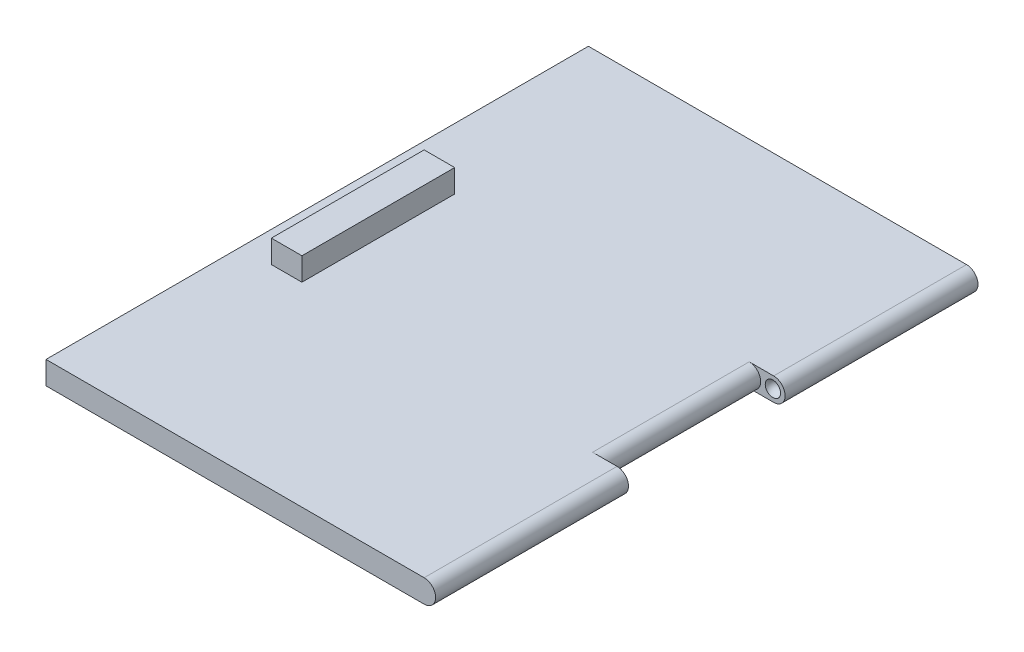
from build123d import *

# Parameters (mm, degrees)
SKETCH1_W           = 51
SKETCH1_H           = 71
BOSS_EXTRUDE1_DEPTH = 3
SKETCH2_W           = 4
SKETCH2_H           = 20
BOSS_EXTRUDE3_DEPTH = 3
SKETCH4_W           = 3.2
SKETCH4_H           = 20.5
CUT_EXTRUDE1_DEPTH  = 5
FILLET1_RADIUS      = 1.5
FILLET1_LENGTH      = 25.25
FILLET2_RADIUS      = 1.5
FILLET2_LENGTH      = 20.5
FILLET3_RADIUS      = 1.5
FILLET3_LENGTH      = 25.25


with BuildPart() as part:
    # Sketch1 → Boss-Extrude1 (new body)
    with BuildSketch(Plane(origin=(0, 0, 0), x_dir=(1, 0, 0), z_dir=(0, 1, 0))):
        Rectangle(SKETCH1_W, SKETCH1_H)
    extrude(amount=BOSS_EXTRUDE1_DEPTH)

    # Sketch2 → Boss-Extrude3 (add)
    with BuildSketch(Plane(origin=(0, 3, 0), x_dir=(1, 0, 0), z_dir=(0, 1, 0))):
        with Locations((-19.5, 0)):
            Rectangle(SKETCH2_W, SKETCH2_H)
    extrude(amount=BOSS_EXTRUDE3_DEPTH)

    # Sketch4 → Cut-Extrude1 (cut)
    with BuildSketch(Plane(origin=(0, 3, 0), x_dir=(1, 0, 0), z_dir=(0, 1, 0))):
        with Locations((23.9, 0)):
            Rectangle(SKETCH4_W, SKETCH4_H)
    extrude(amount=-CUT_EXTRUDE1_DEPTH, mode=Mode.SUBTRACT)

    # Sketch6 → Cut-Revolve1 (revolve, cut)
    with BuildSketch(Plane.XY.offset(-10.25)):
        with BuildLine():
            Line((22.90000003, 1.5), (24.89999997, 1.5))
            ThreePointArc((24.89999997, 1.5), (23.9, 0.50000003), (22.90000003, 1.5))
        make_face()
    cut_revolve1 = revolve(axis=Axis((22.90000003, 1.5, -10.25), (1, 0, 0)), mode=Mode.SUBTRACT)

    # Mirror1: Cut-Revolve1 across plane
    add(cut_revolve1.mirror(Plane.XY), mode=Mode.SUBTRACT)

    # Fillet1: full round fillet: the end face becomes a half cylinder, R = half its width
    fillet1_face = Plane((25.5, 1.5, 22.875), x_dir=(0, 0, 1), z_dir=(1, 0, 0))  # on the end face: x along it, z out of the body
    fillet1_slab = fillet1_face.offset(-FILLET1_RADIUS / 2) * Box(FILLET1_LENGTH, 2 * FILLET1_RADIUS, FILLET1_RADIUS, mode=Mode.PRIVATE)  # the body's end, R deep
    fillet1_round = Plane((24, 1.5, 22.875), x_dir=(1, 0, 0), z_dir=(0, 0, 1)) * Cylinder(FILLET1_RADIUS, FILLET1_LENGTH, mode=Mode.PRIVATE)  # its axis R under the face
    add(fillet1_slab - fillet1_round, mode=Mode.SUBTRACT)

    # Fillet2: full round fillet: the end face becomes a half cylinder, R = half its width
    fillet2_face = Plane((22.3, 1.5, 0), x_dir=(0, 0, -1), z_dir=(1, 0, 0))  # on the end face: x along it, z out of the body
    fillet2_slab = fillet2_face.offset(-FILLET2_RADIUS / 2) * Box(FILLET2_LENGTH, 2 * FILLET2_RADIUS, FILLET2_RADIUS, mode=Mode.PRIVATE)  # the body's end, R deep
    fillet2_round = Plane((20.8, 1.5, 0), x_dir=(1, 0, 0), z_dir=(0, 0, -1)) * Cylinder(FILLET2_RADIUS, FILLET2_LENGTH, mode=Mode.PRIVATE)  # its axis R under the face
    add(fillet2_slab - fillet2_round, mode=Mode.SUBTRACT)

    # Fillet3: full round fillet: the end face becomes a half cylinder, R = half its width
    fillet3_face = Plane((25.5, 1.5, -22.875), x_dir=(0, 0, -1), z_dir=(1, 0, 0))  # on the end face: x along it, z out of the body
    fillet3_slab = fillet3_face.offset(-FILLET3_RADIUS / 2) * Box(FILLET3_LENGTH, 2 * FILLET3_RADIUS, FILLET3_RADIUS, mode=Mode.PRIVATE)  # the body's end, R deep
    fillet3_round = Plane((24, 1.5, -22.875), x_dir=(1, 0, 0), z_dir=(0, 0, -1)) * Cylinder(FILLET3_RADIUS, FILLET3_LENGTH, mode=Mode.PRIVATE)  # its axis R under the face
    add(fillet3_slab - fillet3_round, mode=Mode.SUBTRACT)


solid = part.part
